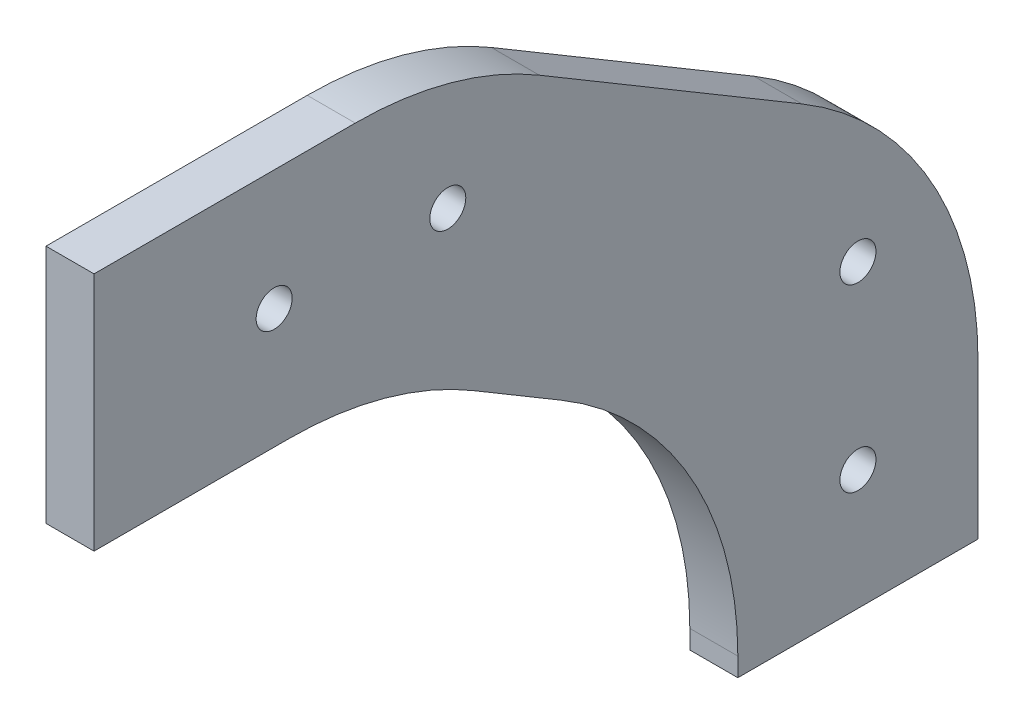
from build123d import *

# Parameters (mm, degrees)
SALIENTE_EXTRUIR1_DEPTH = 4
REDONDEO1_R             = 30
CROQUIS2_R              = 1.5
CORTAR_EXTRUIR1_DEPTH   = 50
CROQUIS3_R              = 1.5
CORTAR_EXTRUIR2_DEPTH   = 10


with BuildPart() as part:
    # Croquis1 → Saliente-Extruir1 (new body)
    with BuildSketch(Plane(origin=(0, 0, 0), x_dir=(0, 0, -1), z_dir=(1, 0, 0))):
        Polygon((45.499640595, 10), (75.499640595, 10), (119.117632426, -15.938244799), (119.117632426, -45.938244799), (99.117632426, -45.938244799), (99.117632426, -27.314001558), (70.002247619, -10), (45.499640595, -10), align=None)
    extrude(amount=SALIENTE_EXTRUIR1_DEPTH)

    # Redondeo1
    redondeo1_edges = [part.edges().sort_by_distance(p)[0] for p in [
        (2, -27.314001558, -99.117632426),
        (2, -10, -70.002247619),
        (2, 10, -75.499640595),
        (2, -15.938244799, -119.117632426),
    ]]
    fillet(redondeo1_edges, radius=REDONDEO1_R)

    # Croquis2 → Cortar-Extruir1 (cut)
    with BuildSketch(Plane(origin=(4, 0, 0), x_dir=(0, 0, -1), z_dir=(1, 0, 0))):
        with Locations((60.499640595, 0)):
            Circle(CROQUIS2_R)
        with Locations((74.959961296, 0)):
            Circle(CROQUIS2_R)
    extrude(amount=-CORTAR_EXTRUIR1_DEPTH, mode=Mode.SUBTRACT)

    # Croquis3 → Cortar-Extruir2 (cut)
    with BuildSketch(Plane(origin=(4, 0, 0), x_dir=(0, 0, -1), z_dir=(1, 0, 0))):
        with Locations((109.117632426, -35.938244799)):
            Circle(CROQUIS3_R)
        with Locations((109.117632426, -20.938244799)):
            Circle(CROQUIS3_R)
    extrude(amount=-CORTAR_EXTRUIR2_DEPTH, mode=Mode.SUBTRACT)


solid = part.part
